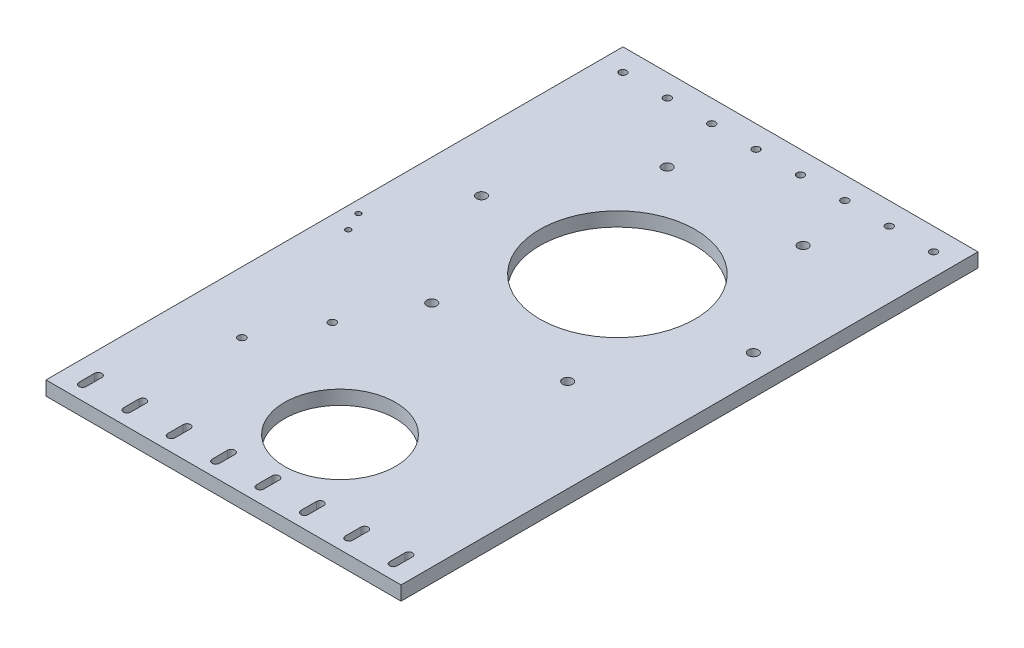
from build123d import *

# Parameters (mm, degrees)
SKETCH1_W           = 160
SKETCH1_H           = 260
SKETCH1_R           = 35
SKETCH1_R_2         = 25
SKETCH1_R_3         = 2.25
SKETCH1_R_4         = 1.175
SKETCH1_R_5         = 1.65
BOSS_EXTRUDE1_DEPTH = 6.35
SKETCH2_R           = 1.7
CUT_EXTRUDE1_DEPTH  = 306.352783678


with BuildPart() as part:
    # Sketch1 → Boss-Extrude1 (new body)
    with BuildSketch(Plane(origin=(0, 0, 0), x_dir=(1, 0, 0), z_dir=(0, 1, 0))):
        with Locations((80, 130)):
            Rectangle(SKETCH1_W, SKETCH1_H)
        with Locations(Location((87.5, 170, 0), (0, 0, 270))):
            Circle(SKETCH1_R, mode=Mode.SUBTRACT)
        with Locations(Location((87.5, 45, 0), (0, 0, 270))):
            Circle(SKETCH1_R_2, mode=Mode.SUBTRACT)
        with Locations(Location((148.75, 170, 0), (0, 0, 270))):
            Circle(SKETCH1_R_3, mode=Mode.SUBTRACT)
        with Locations(Location((118.125, 116.955944018, 0), (0, 0, 270))):
            Circle(SKETCH1_R_3, mode=Mode.SUBTRACT)
        with Locations(Location((56.875, 116.955944018, 0), (0, 0, 270))):
            Circle(SKETCH1_R_3, mode=Mode.SUBTRACT)
        with Locations(Location((26.25, 170, 0), (0, 0, 270))):
            Circle(SKETCH1_R_3, mode=Mode.SUBTRACT)
        with Locations(Location((56.875, 223.044055982, 0), (0, 0, 270))):
            Circle(SKETCH1_R_3, mode=Mode.SUBTRACT)
        with Locations(Location((118.125, 223.044055982, 0), (0, 0, 270))):
            Circle(SKETCH1_R_3, mode=Mode.SUBTRACT)
        with Locations(Location((5.475532842, 135.298909731, 0), (0, 0, 270))):
            Circle(SKETCH1_R_4, mode=Mode.SUBTRACT)
        with Locations(Location((9.516263037, 126.701090269, 0), (0, 0, 270))):
            Circle(SKETCH1_R_4, mode=Mode.SUBTRACT)
        with Locations(Location((10, 250, 0), (0, 0, 270))):
            Circle(SKETCH1_R_5, mode=Mode.SUBTRACT)
        with Locations(Location((30, 250, 0), (0, 0, 270))):
            Circle(SKETCH1_R_5, mode=Mode.SUBTRACT)
        with Locations(Location((50, 250, 0), (0, 0, 270))):
            Circle(SKETCH1_R_5, mode=Mode.SUBTRACT)
        with Locations(Location((70, 250, 0), (0, 0, 270))):
            Circle(SKETCH1_R_5, mode=Mode.SUBTRACT)
        with Locations(Location((90, 250, 0), (0, 0, 270))):
            Circle(SKETCH1_R_5, mode=Mode.SUBTRACT)
        with Locations(Location((110, 250, 0), (0, 0, 270))):
            Circle(SKETCH1_R_5, mode=Mode.SUBTRACT)
        with Locations(Location((130, 250, 0), (0, 0, 270))):
            Circle(SKETCH1_R_5, mode=Mode.SUBTRACT)
        with Locations(Location((150, 250, 0), (0, 0, 270))):
            Circle(SKETCH1_R_5, mode=Mode.SUBTRACT)
        with BuildLine():
            Line((8.35, 6.5), (8.35, 13.5))
            ThreePointArc((8.35, 13.5), (10, 15.15), (11.65, 13.5))
            Line((11.65, 13.5), (11.65, 6.5))
            ThreePointArc((11.65, 6.5), (10, 4.85), (8.35, 6.5))
        make_face(mode=Mode.SUBTRACT)
        with BuildLine():
            Line((31.65, 6.5), (31.65, 13.5))
            ThreePointArc((31.65, 13.5), (30, 15.15), (28.35, 13.5))
            Line((28.35, 13.5), (28.35, 6.5))
            ThreePointArc((28.35, 6.5), (30, 4.85), (31.65, 6.5))
        make_face(mode=Mode.SUBTRACT)
        with BuildLine():
            Line((51.65, 6.5), (51.65, 13.5))
            ThreePointArc((51.65, 13.5), (50, 15.15), (48.35, 13.5))
            Line((48.35, 13.5), (48.35, 6.5))
            ThreePointArc((48.35, 6.5), (50, 4.85), (51.65, 6.5))
        make_face(mode=Mode.SUBTRACT)
        with BuildLine():
            Line((71.65, 6.5), (71.65, 13.5))
            ThreePointArc((71.65, 13.5), (70, 15.15), (68.35, 13.5))
            Line((68.35, 13.5), (68.35, 6.5))
            ThreePointArc((68.35, 6.5), (70, 4.85), (71.65, 6.5))
        make_face(mode=Mode.SUBTRACT)
        with BuildLine():
            Line((91.65, 6.5), (91.65, 13.5))
            ThreePointArc((91.65, 13.5), (90, 15.15), (88.35, 13.5))
            Line((88.35, 13.5), (88.35, 6.5))
            ThreePointArc((88.35, 6.5), (90, 4.85), (91.65, 6.5))
        make_face(mode=Mode.SUBTRACT)
        with BuildLine():
            Line((111.65, 6.5), (111.65, 13.5))
            ThreePointArc((111.65, 13.5), (110, 15.15), (108.35, 13.5))
            Line((108.35, 13.5), (108.35, 6.5))
            ThreePointArc((108.35, 6.5), (110, 4.85), (111.65, 6.5))
        make_face(mode=Mode.SUBTRACT)
        with BuildLine():
            Line((131.65, 6.5), (131.65, 13.5))
            ThreePointArc((131.65, 13.5), (130, 15.15), (128.35, 13.5))
            Line((128.35, 13.5), (128.35, 6.5))
            ThreePointArc((128.35, 6.5), (130, 4.85), (131.65, 6.5))
        make_face(mode=Mode.SUBTRACT)
        with BuildLine():
            Line((151.65, 6.5), (151.65, 13.5))
            ThreePointArc((151.65, 13.5), (150, 15.15), (148.35, 13.5))
            Line((148.35, 13.5), (148.35, 6.5))
            ThreePointArc((148.35, 6.5), (150, 4.85), (151.65, 6.5))
        make_face(mode=Mode.SUBTRACT)
    extrude(amount=BOSS_EXTRUDE1_DEPTH)

    # Sketch2 → Cut-Extrude1 (cut, through all)
    with BuildSketch(Plane(origin=(0, 6.35, 0), x_dir=(1, 0, 0), z_dir=(0, 1, 0))):
        with Locations(Location((27.663890721, 60.64097268, 0), (0, 0, 270))):
            Circle(SKETCH2_R)
        with Locations(Location((42.063890721, 86.95902732, 0), (0, 0, 270))):
            Circle(SKETCH2_R)
    extrude(amount=-CUT_EXTRUDE1_DEPTH, mode=Mode.SUBTRACT)


solid = part.part
